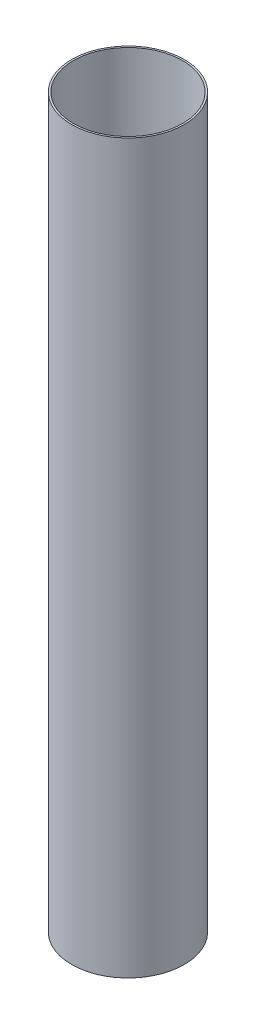
from build123d import *

# Parameters (mm, degrees)
SKETCH2_R           = 39.35
SKETCH2_R_2         = 38.1
BOSS_EXTRUDE1_DEPTH = 508


with BuildPart() as part:
    # Sketch2 → Boss-Extrude1 (new body)
    with BuildSketch(Plane(origin=(0, 0, 0), x_dir=(1, 0, 0), z_dir=(0, 1, 0))):
        with Locations(Location((0, 0, 0), (0, 0, 270))):
            Circle(SKETCH2_R)
        with Locations(Location((0, 0, 0), (0, 0, 270))):
            Circle(SKETCH2_R_2, mode=Mode.SUBTRACT)
    extrude(amount=BOSS_EXTRUDE1_DEPTH)


solid = part.part
